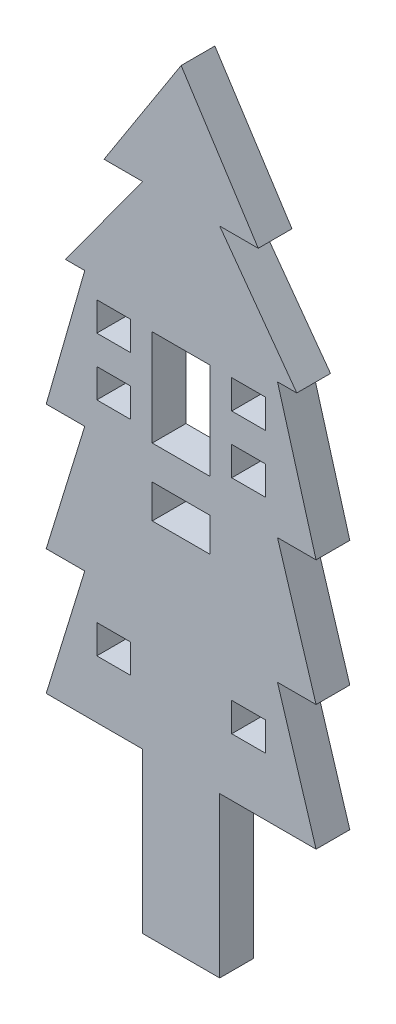
from build123d import *

# Parameters (mm, degrees)
PROFILE_LASER_PROFILE_3P5_W   = 3.5
PROFILE_LASER_PROFILE_3P5_H   = 3
PROFILE_LASER_PROFILE_3P5_W_2 = 6
PROFILE_LASER_PROFILE_3P5_H_2 = 3.5
PROFILE_LASER_PROFILE_3P5_H_3 = 10
LASER_PROFILE_3P5_DEPTH       = 3.5


with BuildPart() as part:
    # Profile_Laser_profile_3p5 → Laser_profile_3p5 (new body)
    with BuildSketch(Plane.XY):
        Polygon((0, 30.427227289), (8, 18), (4, 18), (12, 7), (10, 7), (14, -7), (10, -7), (14, -20), (10, -20), (14, -33), (4, -33), (4, -49.572772711), (-4, -49.572772711), (-4, -33), (-14, -33), (-10, -20), (-14, -20), (-10, -7), (-14, -7), (-10, 7), (-12, 7), (-4, 18), (-8, 18), align=None)
        with Locations((-7, 3.5)):
            Rectangle(PROFILE_LASER_PROFILE_3P5_W, PROFILE_LASER_PROFILE_3P5_H, mode=Mode.SUBTRACT)
        with Locations((-7, -2.5)):
            Rectangle(PROFILE_LASER_PROFILE_3P5_W, PROFILE_LASER_PROFILE_3P5_H, mode=Mode.SUBTRACT)
        with Locations((-7, -25.5)):
            Rectangle(PROFILE_LASER_PROFILE_3P5_W, PROFILE_LASER_PROFILE_3P5_H, mode=Mode.SUBTRACT)
        with Locations((7, 3.5)):
            Rectangle(PROFILE_LASER_PROFILE_3P5_W, PROFILE_LASER_PROFILE_3P5_H, mode=Mode.SUBTRACT)
        with Locations((7, -2.5)):
            Rectangle(PROFILE_LASER_PROFILE_3P5_W, PROFILE_LASER_PROFILE_3P5_H, mode=Mode.SUBTRACT)
        with Locations((7, -25.5)):
            Rectangle(PROFILE_LASER_PROFILE_3P5_W, PROFILE_LASER_PROFILE_3P5_H, mode=Mode.SUBTRACT)
        with Locations((0, -10.25)):
            Rectangle(PROFILE_LASER_PROFILE_3P5_W_2, PROFILE_LASER_PROFILE_3P5_H_2, mode=Mode.SUBTRACT)
        Rectangle(PROFILE_LASER_PROFILE_3P5_W_2, PROFILE_LASER_PROFILE_3P5_H_3, mode=Mode.SUBTRACT)
    extrude(amount=LASER_PROFILE_3P5_DEPTH)


solid = part.part
